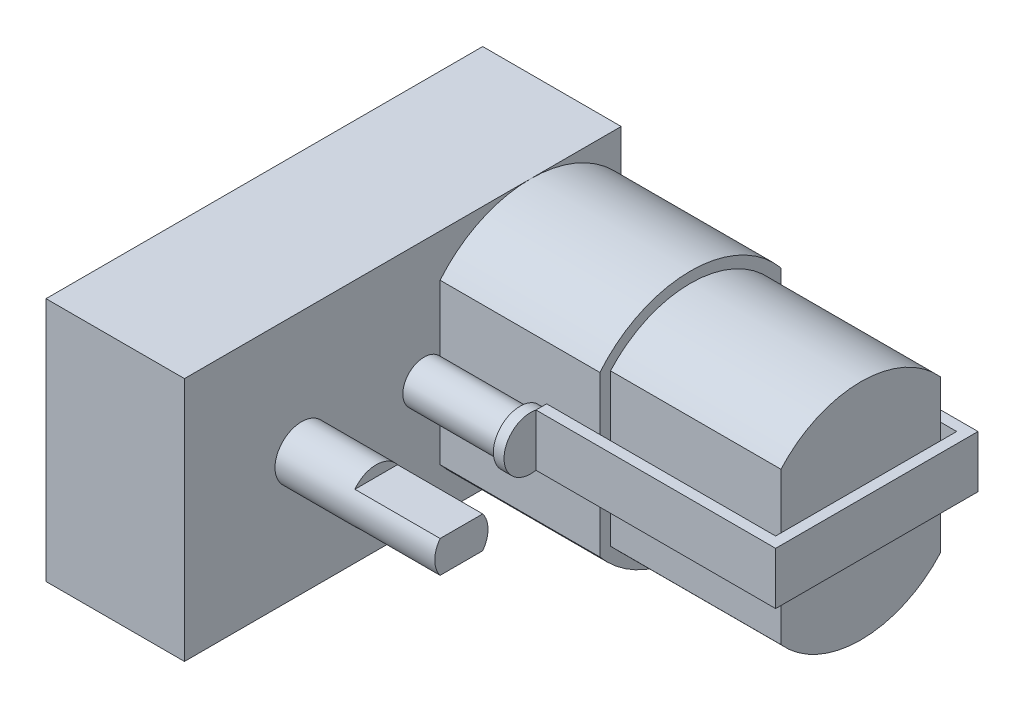
from build123d import *

# Parameters (mm, degrees)
SKETCH_1_W           = 41
SKETCH_1_H           = 23
EXTRUDE_1_DEPTH      = 13
EXTRUDE_2_DEPTH      = 15
EXTRUDE_2_DEPTH_BACK = 21
SKETCH_2_R           = 2.5
EXTRUDE_3_DEPTH      = 2
EXTRUDE_3_DEPTH_BACK = 22
SKETCH_3_R           = 2
SKETCH_3_R_2         = 2.5
CUT_EXTRUDE_1_DEPTH  = 7
CUT_EXTRUDE_2_DEPTH  = 8
EXTRUDE_4_DEPTH      = 15
EXTRUDE_5_DEPTH      = 16
EXTRUDE_10_DEPTH     = 9
EXTRUDE_7_DEPTH      = 1
SKETCH_12_W          = 1
SKETCH_12_H          = 4.898979486
EXTRUDE_11_DEPTH     = 21.5
SKETCH_13_W          = 19
SKETCH_13_H          = 4.898979486
EXTRUDE_12_DEPTH     = 1


with BuildPart() as part:
    # 스케치1 → 보스-돌출1 (new body)
    with BuildSketch(Plane(origin=(0, 0, 0), x_dir=(0, 0, -1), z_dir=(1, 0, 0))):
        Rectangle(SKETCH_1_W, SKETCH_1_H)
    extrude(amount=-EXTRUDE_1_DEPTH)

    # 스케치2 → 보스-돌출2 (add, two sides: drawn at the far end of the back side and taken through both)
    with BuildSketch(Plane(origin=(0, 0, 0), x_dir=(0, 0, -1), z_dir=(1, 0, 0)).offset(-EXTRUDE_2_DEPTH_BACK)):
        with Locations((-9.5, 0)):
            Circle(SKETCH_2_R)
    extrude(amount=EXTRUDE_2_DEPTH + EXTRUDE_2_DEPTH_BACK)

    # 스케치3 → 보스-돌출3 (add, two sides: drawn at the far end of the back side and taken through both)
    with BuildSketch(Plane.ZY.offset(13).offset(-EXTRUDE_3_DEPTH_BACK)):
        with Locations((-2, 0)):
            Circle(SKETCH_3_R)
        with Locations(Location((9.5, 0, 0), (0, 0, 180))):
            Circle(SKETCH_3_R_2)
    extrude(amount=EXTRUDE_3_DEPTH + EXTRUDE_3_DEPTH_BACK)

    # 스케치5 → 컷-돌출1 (cut)
    with BuildSketch(Plane.ZY.offset(21)):
        with BuildLine():
            Line((7.5, 1.5), (11.5, 1.5))
            ThreePointArc((11.5, 1.5), (9.5, 2.5), (7.5, 1.5))
        make_face()
        with BuildLine():
            Line((7.5, -1.5), (11.5, -1.5))
            ThreePointArc((11.5, -1.5), (9.5, -2.5), (7.5, -1.5))
        make_face()
    extrude(amount=-CUT_EXTRUDE_1_DEPTH, mode=Mode.SUBTRACT)

    # 스케치6 → 컷-돌출2 (cut)
    with BuildSketch(Plane(origin=(15, 0, 0), x_dir=(0, 0, -1), z_dir=(1, 0, 0))):
        with BuildLine():
            Line((-11.5, 1.5), (-7.5, 1.5))
            ThreePointArc((-7.5, 1.5), (-9.5, 2.5), (-11.5, 1.5))
        make_face()
        with BuildLine():
            Line((-11.5, -1.5), (-7.5, -1.5))
            ThreePointArc((-7.5, -1.5), (-9.5, -2.5), (-11.5, -1.5))
        make_face()
    extrude(amount=-CUT_EXTRUDE_2_DEPTH, mode=Mode.SUBTRACT)

    # 스케치7 → 보스-돌출4 (add)
    with BuildSketch(Plane(origin=(0, 0, 0), x_dir=(0, 0, -1), z_dir=(1, 0, 0))):
        with BuildLine():
            Line((3.5, 7.5), (3.5, -7.5))
            ThreePointArc((3.5, -7.5), (12, -11.5), (20.5, -7.5))
            Line((20.5, -7.5), (20.5, 7.5))
            ThreePointArc((20.5, 7.5), (12, 11.5), (3.5, 7.5))
        make_face()
    extrude(amount=EXTRUDE_4_DEPTH)

    # 스케치8 → 보스-돌출5 (add)
    with BuildSketch(Plane(origin=(15, 0, 0), x_dir=(0, 0, -1), z_dir=(1, 0, 0))):
        with BuildLine():
            Line((4.5, 7.130279596), (4.5, -7.130279596))
            ThreePointArc((4.5, -7.130279596), (12, -10.5), (19.5, -7.130279596))
            Line((19.5, -7.130279596), (19.5, 7.130279596))
            ThreePointArc((19.5, 7.130279596), (12, 10.5), (4.5, 7.130279596))
        make_face()
    extrude(amount=EXTRUDE_5_DEPTH)

    # 스케치10 → 보스-돌출10 (add)
    with BuildSketch(Plane(origin=(0, 0, 0), x_dir=(0, 0, -1), z_dir=(1, 0, 0))):
        with BuildLine():
            ThreePointArc((20.5, 1.322875656), (20, 0), (20.5, -1.322875656))
            Line((20.5, -1.322875656), (20.5, 1.322875656))
        make_face()
        with BuildLine():
            Line((20.5, 1.322875656), (20.5, -1.322875656))
            ThreePointArc((20.5, -1.322875656), (21.177124344, -1.822875656), (22, -2))
            ThreePointArc((22, -2), (23.414213562, -1.414213562), (24, 0))
            ThreePointArc((24, 0), (23.414213562, 1.414213562), (22, 2))
            ThreePointArc((22, 2), (21.177124344, 1.822875656), (20.5, 1.322875656))
        make_face()
    extrude(amount=EXTRUDE_10_DEPTH)

    # 스케치11 → 보스-돌출7 (add)
    with BuildSketch(Plane(origin=(9, 0, 0), x_dir=(0, 0, -1), z_dir=(1, 0, 0))):
        with BuildLine():
            Line((20, -1.5), (20, 1.5))
            ThreePointArc((20, 1.5), (24.5, 0), (20, -1.5))
        make_face()
        with BuildLine():
            Line((4, -1.5), (4, 1.5))
            ThreePointArc((4, 1.5), (-0.5, 0), (4, -1.5))
        make_face()
    extrude(amount=EXTRUDE_7_DEPTH)

    # 스케치12 → 보스-돌출11 (add)
    with BuildSketch(Plane(origin=(10, 0, 0), x_dir=(0, 0, -1), z_dir=(1, 0, 0))):
        with Locations((21, 0)):
            Rectangle(SKETCH_12_W, SKETCH_12_H)
        with Locations((3, 0)):
            Rectangle(SKETCH_12_W, SKETCH_12_H)
    extrude(amount=EXTRUDE_11_DEPTH)

    # 스케치13 → 보스-돌출12 (add)
    with BuildSketch(Plane(origin=(31.5, 0, 0), x_dir=(0, 0, -1), z_dir=(1, 0, 0))):
        with Locations((12, 0)):
            Rectangle(SKETCH_13_W, SKETCH_13_H)
    extrude(amount=EXTRUDE_12_DEPTH)


solid = part.part
